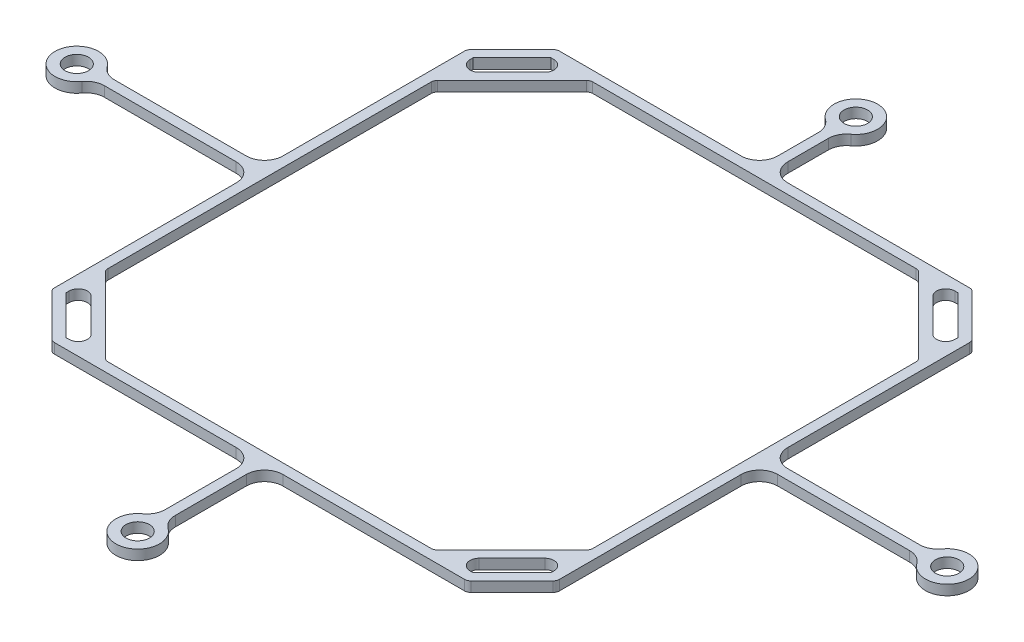
from build123d import *

# Parameters (mm, degrees)
SKETCH1_R           = 1.925
BOSS_EXTRUDE1_DEPTH = 1.65
FILLET4_R           = 3
FILLET3_R           = 1.5
FILLET5_R           = 1


with BuildPart() as part:
    # Sketch1 → Boss-Extrude1 (new body)
    with BuildSketch(Plane(origin=(0, 0, 0), x_dir=(1, 0, 0), z_dir=(0, 1, 0))):
        with BuildLine():
            Line((-41.448800006, 34.091704203), (-34.091704203, 41.448800006))
            Line((-34.091704203, 41.448800006), (-0.825, 41.448800006))
            Line((-0.825, 41.448800006), (-0.825, 52.97029458))
            ThreePointArc((-0.825, 52.97029458), (0, 60.023800006), (0.825, 52.97029458))
            Line((0.825, 52.97029458), (0.825, 41.448800006))
            Line((0.825, 41.448800006), (34.091704203, 41.448800006))
            Line((34.091704203, 41.448800006), (41.448800006, 34.091704203))
            Line((41.448800006, 34.091704203), (41.448800006, 0.825))
            Line((41.448800006, 0.825), (67.97029458, 0.825))
            ThreePointArc((67.97029458, 0.825), (75.023800006, 0), (67.97029458, -0.825))
            Line((67.97029458, -0.825), (41.448800006, -0.825))
            Line((41.448800006, -0.825), (41.448800006, -34.091704203))
            Line((41.448800006, -34.091704203), (34.091704203, -41.448800006))
            Line((34.091704203, -41.448800006), (0.825, -41.448800006))
            Line((0.825, -41.448800006), (0.825, -57.97029458))
            ThreePointArc((0.825, -57.97029458), (0, -65.023800006), (-0.825, -57.97029458))
            Line((-0.825, -57.97029458), (-0.825, -41.448800006))
            Line((-0.825, -41.448800006), (-34.091704203, -41.448800006))
            Line((-34.091704203, -41.448800006), (-41.448800006, -34.091704203))
            Line((-41.448800006, -34.091704203), (-41.448800006, -0.825))
            Line((-41.448800006, -0.825), (-67.97029458, -0.825))
            ThreePointArc((-67.97029458, -0.825), (-75.023800006, 0), (-67.97029458, 0.825))
            Line((-67.97029458, 0.825), (-41.448800006, 0.825))
            Line((-41.448800006, 0.825), (-41.448800006, 34.091704203))
        make_face()
        with Locations(Location((0, 56.448800006, 0), (0, 0, 270))):
            Circle(SKETCH1_R, mode=Mode.SUBTRACT)
        with Locations(Location((71.448800006, 0, 0), (0, 0, 90))):
            Circle(SKETCH1_R, mode=Mode.SUBTRACT)
        with Locations(Location((0, -61.448800006, 0), (0, 0, 270))):
            Circle(SKETCH1_R, mode=Mode.SUBTRACT)
        with Locations(Location((-71.448800006, 0, 0), (0, 0, 270))):
            Circle(SKETCH1_R, mode=Mode.SUBTRACT)
        Polygon((-39.798800006, 33.408251825), (-33.408251825, 39.798800006), (-29.292890359, 39.798800006), (-39.798800006, 29.292890359), align=None, mode=Mode.SUBTRACT)
        Polygon((-33.408251825, -39.798800006), (-29.292890359, -39.798800006), (-39.798800006, -29.292890359), (-39.798800006, -33.408251825), align=None, mode=Mode.SUBTRACT)
        Polygon((39.798800006, -33.408251825), (39.798800006, -29.292890359), (29.292890359, -39.798800006), (33.408251825, -39.798800006), align=None, mode=Mode.SUBTRACT)
        Polygon((33.408251825, 39.798800006), (39.798800006, 33.408251825), (39.798800006, 29.292890359), (29.292890359, 39.798800006), align=None, mode=Mode.SUBTRACT)
        Polygon((-39.798800006, 26.959437981), (-26.959437981, 39.798800006), (26.959437981, 39.798800006), (39.798800006, 26.959437981), (39.798800006, -26.959437981), (26.959437981, -39.798800006), (-26.959437981, -39.798800006), (-39.798800006, -26.959437981), align=None, mode=Mode.SUBTRACT)
    extrude(amount=BOSS_EXTRUDE1_DEPTH)

    # Fillet4
    fillet4_edges = [part.edges().sort_by_distance(p)[0] for p in [
        (-0.825, 0.825, -41.448800006),
        (-0.825, 0.825, -52.97029458),
        (0.825, 0.825, -52.97029458),
        (0.825, 0.825, -41.448800006),
        (41.448800006, 0.825, -0.825),
        (67.97029458, 0.825, -0.825),
        (67.97029458, 0.825, 0.825),
        (41.448800006, 0.825, 0.825),
        (0.825, 0.825, 41.448800006),
        (0.825, 0.825, 57.97029458),
        (-0.825, 0.825, 57.97029458),
        (-0.825, 0.825, 41.448800006),
        (-41.448800006, 0.825, 0.825),
        (-67.97029458, 0.825, 0.825),
        (-67.97029458, 0.825, -0.825),
        (-41.448800006, 0.825, -0.825),
    ]]
    fillet(fillet4_edges, radius=FILLET4_R)

    # Fillet3
    fillet3_edges = [part.edges().sort_by_distance(p)[0] for p in [
        (-29.292890359, 0.825, 39.798800006),
        (-39.798800006, 0.825, 29.292890359),
        (-39.798800006, 0.825, -29.292890359),
        (-29.292890359, 0.825, -39.798800006),
        (29.292890359, 0.825, -39.798800006),
        (39.798800006, 0.825, -29.292890359),
        (39.798800006, 0.825, 29.292890359),
        (29.292890359, 0.825, 39.798800006),
    ]]
    fillet(fillet3_edges, radius=FILLET3_R)

    # Fillet5
    fillet5_edges = [part.edges().sort_by_distance(p)[0] for p in [
        (-39.798800006, 0.825, -26.959437981),
        (-39.798800006, 0.825, 26.959437981),
        (-26.959437981, 0.825, 39.798800006),
        (26.959437981, 0.825, 39.798800006),
        (39.798800006, 0.825, 26.959437981),
        (39.798800006, 0.825, -26.959437981),
        (26.959437981, 0.825, -39.798800006),
        (-26.959437981, 0.825, -39.798800006),
        (-41.448800006, 0.825, -34.091704203),
        (-34.091704203, 0.825, -41.448800006),
        (34.091704203, 0.825, -41.448800006),
        (41.448800006, 0.825, -34.091704203),
        (41.448800006, 0.825, 34.091704203),
        (34.091704203, 0.825, 41.448800006),
        (-34.091704203, 0.825, 41.448800006),
        (-41.448800006, 0.825, 34.091704203),
    ]]
    fillet(fillet5_edges, radius=FILLET5_R)


solid = part.part
